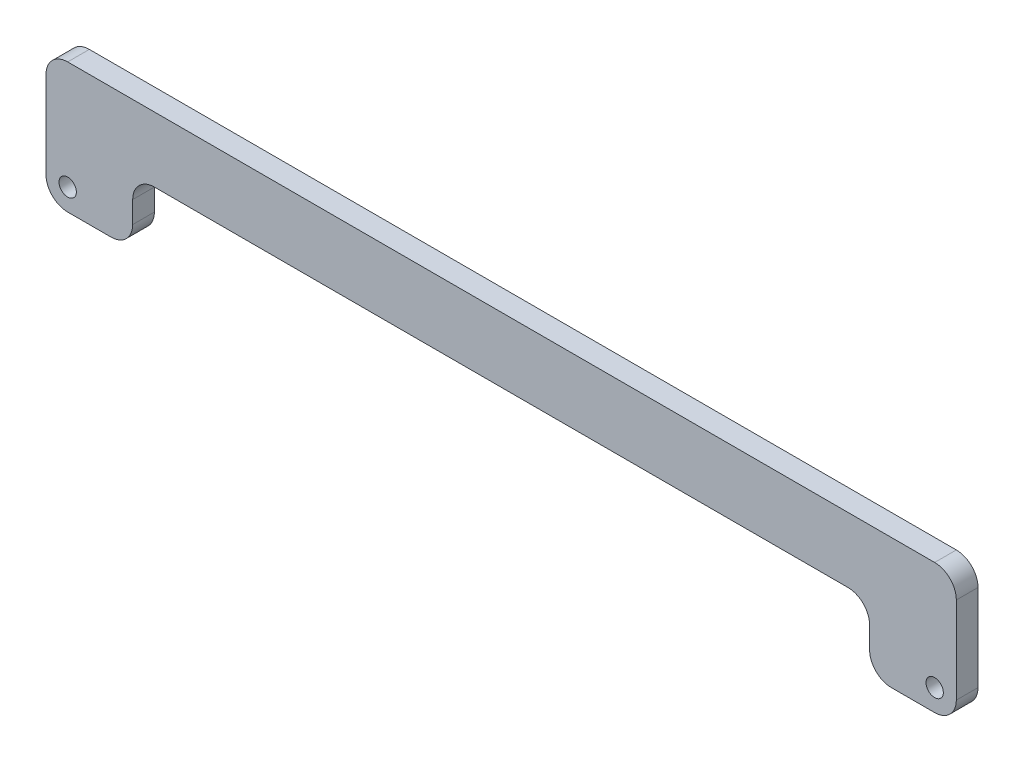
from build123d import *

# Parameters (mm, degrees)
ESQUISSE1_R        = 2
BOSS_EXTRU_1_DEPTH = 5
CONG_1_R           = 5


with BuildPart() as part:
    # Esquisse1 → Boss.-Extru.1 (new body)
    with BuildSketch(Plane.XY):
        Polygon((0, 0), (0, 30), (210, 30), (210, 0), (190, 0), (190, 15), (20, 15), (20, 0), align=None)
        with Locations((5, 5)):
            Circle(ESQUISSE1_R, mode=Mode.SUBTRACT)
        with Locations((205, 5)):
            Circle(ESQUISSE1_R, mode=Mode.SUBTRACT)
    extrude(amount=BOSS_EXTRU_1_DEPTH)

    # Congé1
    cong_1_edges = [part.edges().sort_by_distance(p)[0] for p in [
        (0, 0, 2.5),
        (0, 30, 2.5),
        (210, 30, 2.5),
        (210, 0, 2.5),
        (190, 0, 2.5),
        (190, 15, 2.5),
        (20, 15, 2.5),
        (20, 0, 2.5),
    ]]
    fillet(cong_1_edges, radius=CONG_1_R)


solid = part.part
